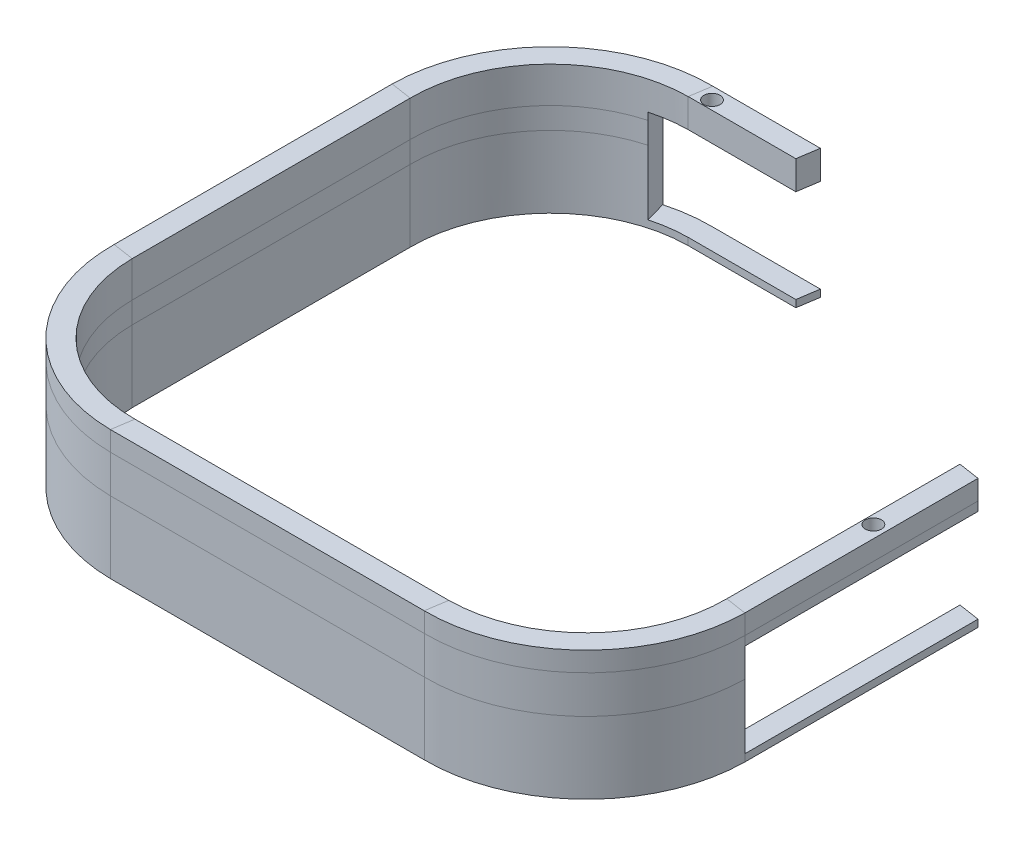
from build123d import *

# Parameters (mm, degrees)
SKETCH6_W                     = 2.25
SKETCH6_H                     = 12
M4_CLEARANCE_HOLE1_AT_2_COUNT = 2
M4_CLEARANCE_HOLE1_AT_2_PITCH = 148.408220797
CUT_EXTRUDE1_START            = -24
CUT_EXTRUDE1_DEPTH            = 26


with BuildPart() as part:
    # Sweep1: sweep along a path in Sketch1
    with BuildLine(Plane(origin=(0, 152.68757152, 0), x_dir=(1, 0, 0), z_dir=(0, 1, 0))) as sweep1_path:
        Line((82.38365074, -11.079514347), (82.38365074, -76.079514347))
        ThreePointArc((82.38365074, -76.079514347), (70.301805464, -105.247669071), (41.13365074, -117.329514347))
        Line((41.13365074, -117.329514347), (-46.36634926, -117.329514347))
        ThreePointArc((-46.36634926, -117.329514347), (-75.534503984, -105.247669071), (-87.61634926, -76.079514347))
        Line((-87.61634926, -76.079514347), (-87.61634926, 1.420485653))
        ThreePointArc((-87.61634926, 1.420485653), (-75.534503984, 30.588640377), (-46.36634926, 42.670485653))
        Line((-46.36634926, 42.670485653), (-16.36634926, 42.670485653))
    # Sketch2 → Sweep1 (sweep)
    with BuildSketch(Plane.ZY.offset(52.61634926)):
        Polygon((-45.670485653, 153.211679549), (-45.670485653, 158.68757152), (-39.670485653, 158.68757152), (-39.670485653, 148.68757152), (-39.670485653, 142.68757152), (-39.670485653, 122.68757152), (-45.670485653, 122.68757152), (-45.670485653, 142.68757152), align=None)
    sweep(path=sweep1_path.line)

    # Sketch6 → M4 Clearance Hole1 (revolve, cut)
    with BuildSketch(Plane(origin=(-42.61634926, 146.68757152, -42.670485653), x_dir=(0, 0, -1), z_dir=(1, 0, 0))):
        with Locations((1.125, 6)):
            Rectangle(SKETCH6_W, SKETCH6_H)
    m4_clearance_hole1 = revolve(axis=Axis((-42.61634926, 140.33757152, -42.670485653), (0, 1, 0)), mode=Mode.SUBTRACT)

    # M4 Clearance Hole1 at 2: M4 Clearance Hole1 ×2
    with Locations(*[Vector(0.8422714006615114, 0, 0.5390536964233672) * (i * M4_CLEARANCE_HOLE1_AT_2_PITCH) for i in range(1, M4_CLEARANCE_HOLE1_AT_2_COUNT)]):
        add(m4_clearance_hole1, mode=Mode.SUBTRACT)

    # Sketch7 → Cut-Extrude1 (cut)
    with BuildSketch(Plane(origin=(0, 148.68757152, 0), x_dir=(1, 0, 0), z_dir=(0, 1, 0)).offset(CUT_EXTRUDE1_START)):
        Polygon((79.889021707, -75.697125548), (85.819751318, -76.606216457), (85.819751318, -11.606216457), (79.889021707, -10.697125548), align=None)
        with BuildLine():
            Line((-46.748738059, 40.17585662), (-16.748738059, 40.17585662))
            Line((-16.748738059, 40.17585662), (-15.83964715, 46.106586231))
            Line((-15.83964715, 46.106586231), (-45.83964715, 46.106586231))
            ThreePointArc((-45.83964715, 46.106586231), (-52.06795996, 45.744481811), (-58.185151135, 44.518524149))
            Line((-58.185151135, 44.518524149), (-56.61634926, 38.797784913))
            ThreePointArc((-56.61634926, 38.797784913), (-51.727010908, 39.805226198), (-46.748738059, 40.17585662))
        make_face()
    extrude(amount=CUT_EXTRUDE1_DEPTH, mode=Mode.SUBTRACT)


solid = part.part
